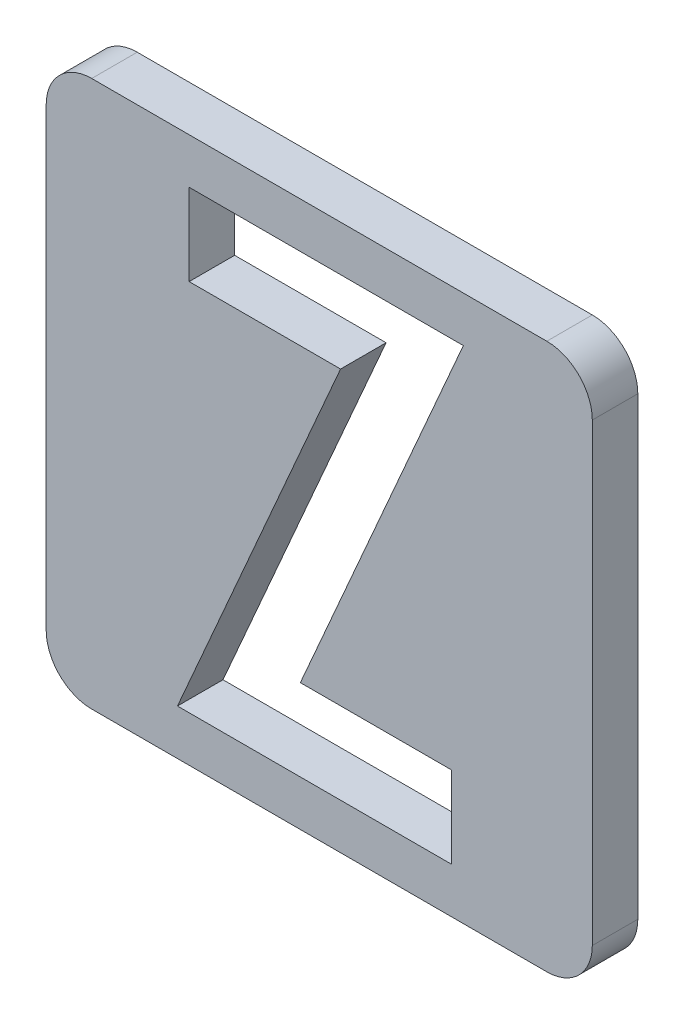
from build123d import *

# Parameters (mm, degrees)
BOSS_EXTRUDE1_DEPTH = 10
CUT_EXTRUDE39_DEPTH = 10


with BuildPart() as part:
    # Sketch1 → Boss-Extrude1 (new body)
    with BuildSketch(Plane.XY):
        with BuildLine():
            Line((-50, 60), (50, 60))
            ThreePointArc((50, 60), (57.071067812, 57.071067812), (60, 50))
            Line((60, 50), (60, -50))
            ThreePointArc((60, -50), (57.071067812, -57.071067812), (50, -60))
            Line((50, -60), (-50, -60))
            ThreePointArc((-50, -60), (-57.071067812, -57.071067812), (-60, -50))
            Line((-60, -50), (-60, 50))
            ThreePointArc((-60, 50), (-57.071067812, 57.071067812), (-50, 60))
        make_face()
    extrude(amount=BOSS_EXTRUDE1_DEPTH)

    # Sketch2 → Cut-Extrude39 (cut)
    with BuildSketch(Plane.XY.offset(10)):
        Polygon((-28.58974359, 50), (31.666666667, 50), (-4.150641026, -32.051282051), (29.102564103, -32.051282051), (29.102564103, -50), (-31.153846154, -50), (4.68349359, 32.051282051), (-28.58974359, 32.051282051), align=None)
    extrude(amount=-CUT_EXTRUDE39_DEPTH, mode=Mode.SUBTRACT)


solid = part.part
